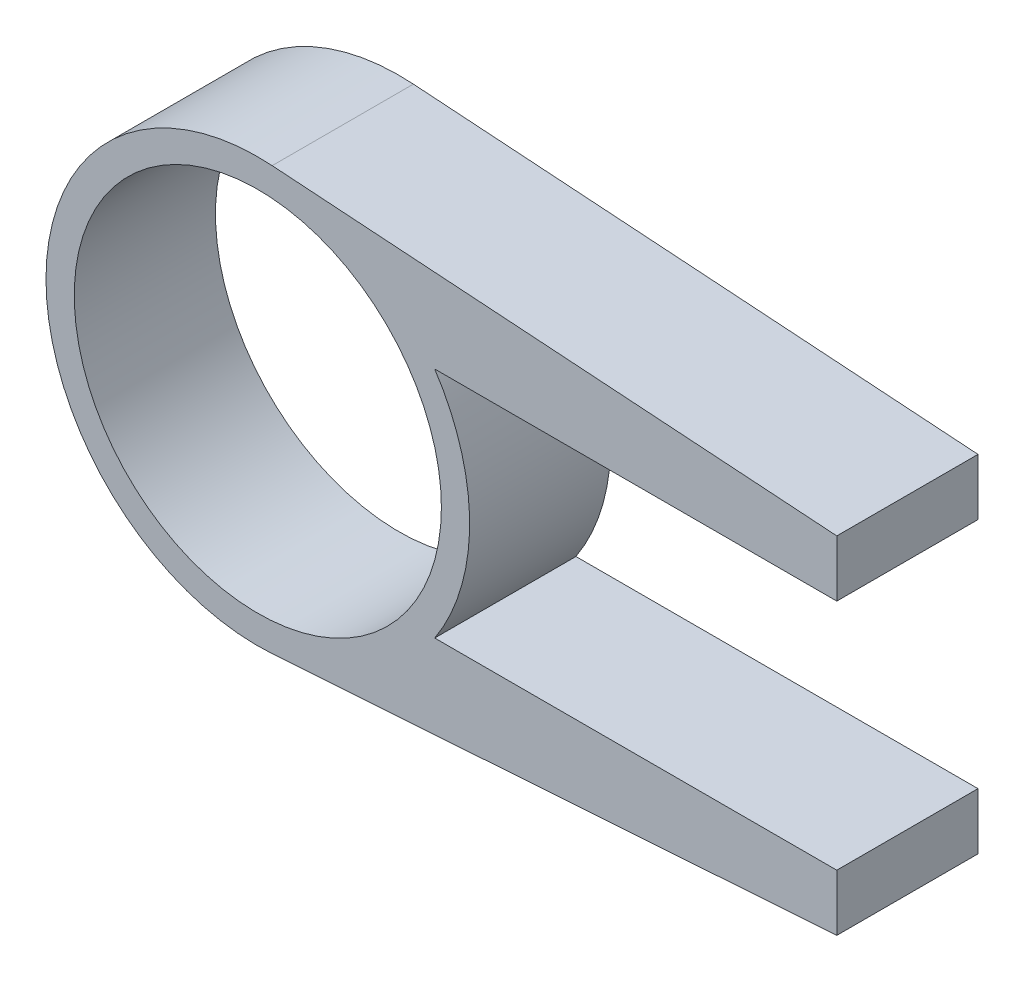
from build123d import *

# Parameters (mm, degrees)
BOSS_EXTRUDE2_DEPTH      = 31.75
BOSS_EXTRUDE2_DEPTH_BACK = 31.75
CUT_EXTRUDE3_REACH       = 286.406
SKETCH2_R                = 82.55


with BuildPart() as part:
    # Sketch1 → Boss-Extrude2 (new, two sides: drawn at the far end of the back side and taken through both)
    with BuildSketch(Plane.XY.offset(-BOSS_EXTRUDE2_DEPTH_BACK)):
        with BuildLine():
            Line((79.549433334, -52.3875), (260.35, -52.3875))
            Line((260.35, -52.3875), (260.35, -77.7875))
            Line((260.35, -77.7875), (6.45412764, -95.031083001))
            ThreePointArc((6.45412764, -95.031083001), (-95.25, 0), (6.45412764, 95.031083001))
            Line((6.45412764, 95.031083001), (260.35, 77.7875))
            Line((260.35, 77.7875), (260.35, 52.3875))
            Line((260.35, 52.3875), (79.549433334, 52.3875))
            ThreePointArc((79.549433334, 52.3875), (95.25, 0), (79.549433334, -52.3875))
        make_face()
    extrude(amount=BOSS_EXTRUDE2_DEPTH + BOSS_EXTRUDE2_DEPTH_BACK)

    # Sketch2 → Cut-Extrude3 (cut, up to next)
    with BuildSketch(Plane.XY.offset(31.75), mode=Mode.PRIVATE) as cut_extrude3_sk1:
        Circle(SKETCH2_R)
    cut_extrude3_tool1 = extrude(cut_extrude3_sk1.sketch, amount=-CUT_EXTRUDE3_REACH, mode=Mode.PRIVATE) & part.part
    add(cut_extrude3_tool1.solids().sort_by_distance((0, 0, 31.75))[0], mode=Mode.SUBTRACT)


solid = part.part
